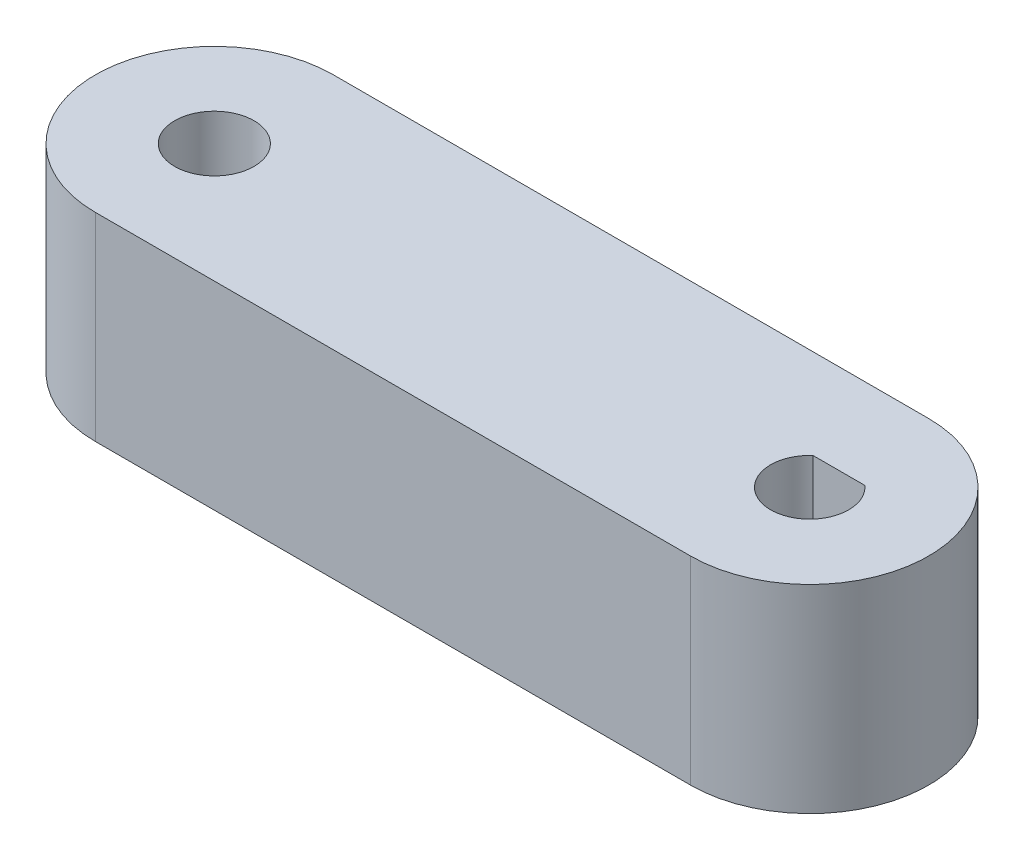
from build123d import *

# Parameters (mm, degrees)
BOSS_EXTRUDE1_DEPTH = 12.7
SKETCH4_R           = 2.54
CUT_EXTRUDE3_DEPTH  = 43.063657711
CUT_EXTRUDE4_DEPTH  = 43.063657711


with BuildPart() as part:
    # Sketch3 → Boss-Extrude1 (new body)
    with BuildSketch(Plane(origin=(0, 0, 0), x_dir=(1, 0, 0), z_dir=(0, 1, 0))):
        with BuildLine():
            Line((-31.75, 7.62), (6.35, 7.62))
            ThreePointArc((6.35, 7.62), (13.97, 0), (6.35, -7.62))
            Line((6.35, -7.62), (-31.75, -7.62))
            ThreePointArc((-31.75, -7.62), (-39.37, 0), (-31.75, 7.62))
        make_face()
    extrude(amount=BOSS_EXTRUDE1_DEPTH)

    # Sketch4 → Cut-Extrude3 (cut, through all)
    with BuildSketch(Plane(origin=(0, 12.7, 0), x_dir=(1, 0, 0), z_dir=(0, 1, 0))):
        with Locations(Location((-31.75, 0, 0), (0, 0, 270))):
            Circle(SKETCH4_R)
    extrude(amount=-CUT_EXTRUDE3_DEPTH, mode=Mode.SUBTRACT)

    # Sketch6 → Cut-Extrude4 (cut, through all)
    with BuildSketch(Plane(origin=(0, 12.7, 0), x_dir=(1, 0, 0), z_dir=(0, 1, 0))):
        with BuildLine():
            Line((8.00881749, 1.870380853), (4.69118251, 1.870380853))
            ThreePointArc((4.69118251, 1.870380853), (5.32458392, -2.280026724), (8.85, 0))
            ThreePointArc((8.85, 0), (8.630026724, 1.02541608), (8.00881749, 1.870380853))
        make_face()
    extrude(amount=-CUT_EXTRUDE4_DEPTH, mode=Mode.SUBTRACT)


solid = part.part
